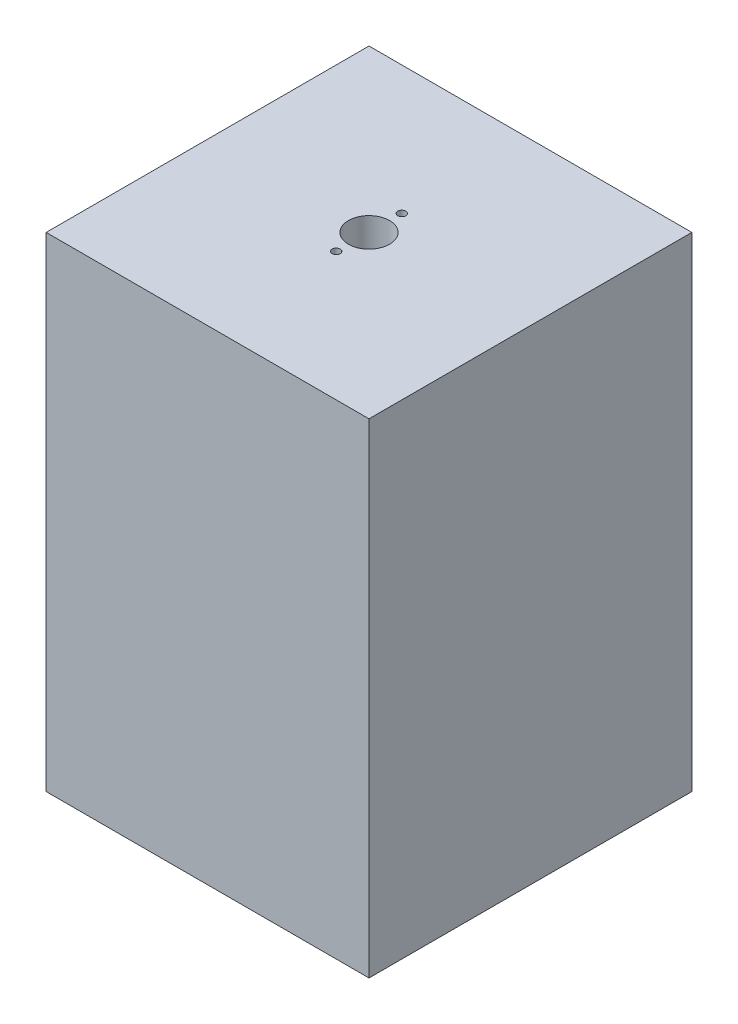
from build123d import *

# Parameters (mm, degrees)
SKETCH1_W           = 101.6
SKETCH1_H           = 101.6
BOSS_EXTRUDE1_DEPTH = 76.2
SKETCH2_R           = 6.477
SKETCH2_R_2         = 1.27
CUT_EXTRUDE1_DEPTH  = 12.7


with BuildPart() as part:
    # Sketch1 → Boss-Extrude1 (new, symmetric)
    with BuildSketch(Plane(origin=(0, 0, 0), x_dir=(1, 0, 0), z_dir=(0, 1, 0))):
        Rectangle(SKETCH1_W, SKETCH1_H)
    extrude(amount=BOSS_EXTRUDE1_DEPTH, both=True)

    # Sketch2 → Cut-Extrude1 (cut)
    with BuildSketch(Plane(origin=(0, 76.2, 0), x_dir=(1, 0, 0), z_dir=(0, 1, 0))):
        with Locations(Location((0, 0, 0), (0, 0, 270))):
            Circle(SKETCH2_R)
        with Locations(Location((0, 10.3251, 0), (0, 0, 270))):
            Circle(SKETCH2_R_2)
        with Locations(Location((0, -10.3251, 0), (0, 0, 270))):
            Circle(SKETCH2_R_2)
    extrude(amount=-CUT_EXTRUDE1_DEPTH, mode=Mode.SUBTRACT)


solid = part.part
